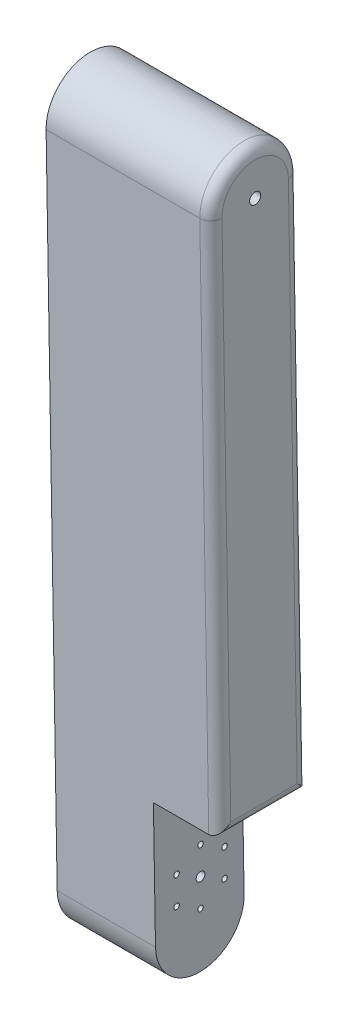
from build123d import *

# Parameters (mm, degrees)
EXTRUDE_3_DEPTH          = 74.4
CUT_EXTRUDE_1_DEPTH      = 30
FILLET_1_R               = 5
CUT_EXTRUDE_6_DEPTH      = 330.484992071
CUT_EXTRUDE_6_DEPTH_BACK = 330.484992071
SKETCH_13_R              = 1.25
CUT_EXTRUDE_7_DEPTH      = 330.484992071
CUT_EXTRUDE_7_DEPTH_BACK = 330.484992071
SKETCH_14_R              = 2
SKETCH_15_R              = 2.5
CUT_EXTRUDE_8_DEPTH      = 100


with BuildPart() as part:
    # 草图4 → 凸台-拉伸3 (new body)
    with BuildSketch(Plane(origin=(0, 0, 0), x_dir=(0, 0, -1), z_dir=(1, 0, 0))):
        with BuildLine():
            Line((-19.997222801, -0.333287047), (-14.997222801, -300.333287047))
            ThreePointArc((-14.997222801, -300.333287047), (5.333287047, -319.997222801), (24.997222801, -299.666712953))
            Line((24.997222801, -299.666712953), (19.997222801, 0.333287047))
            ThreePointArc((19.997222801, 0.333287047), (-0.333287047, 19.997222801), (-19.997222801, -0.333287047))
        make_face()
    extrude(amount=EXTRUDE_3_DEPTH)

    # 草图8 → 切除-拉伸1 (cut)
    with BuildSketch(Plane(origin=(74.4, 0, 0), x_dir=(0, 0, -1), z_dir=(1, 0, 0))):
        with BuildLine():
            Line((-15.947486862, -243.317443397), (24.058068308, -243.317443397))
            Line((24.058068308, -243.317443397), (24.997222801, -299.666712953))
            ThreePointArc((24.997222801, -299.666712953), (4.858283924, -320.480273081), (-15.947486862, -300.333287047))
            Line((-15.947486862, -300.333287047), (-15.947486862, -243.317443397))
        make_face()
    extrude(amount=-CUT_EXTRUDE_1_DEPTH, mode=Mode.SUBTRACT)

    # 圆角1
    fillet_1_edges = [part.edges().sort_by_distance(p)[0] for p in [
        (74.4, -121.492078175, -22.027645554),
        (74.4, -243.317443397, -4.055290723),
        (74.4, 19.997222801, 0.333287047),
        (74.4, -121.825365222, 17.972354831),
    ]]
    fillet(fillet_1_edges, radius=FILLET_1_R)

    # 草图13 → 切除-拉伸6 (cut, two sides: drawn at the far end of the back side and taken through both)
    with BuildSketch(Plane.ZY.offset(-CUT_EXTRUDE_6_DEPTH_BACK)):
        with Locations(Location((-5.333287046, -270.358832161, 0), (0, 0, 180))):
            Circle(SKETCH_13_R)
        with Locations(Location((5.492030501, -276.608832161, 0), (0, 0, 180))):
            Circle(SKETCH_13_R)
        with Locations(Location((5.492030501, -289.108832161, 0), (0, 0, 180))):
            Circle(SKETCH_13_R)
        with Locations(Location((-5.333287046, -295.358832161, 0), (0, 0, 180))):
            Circle(SKETCH_13_R)
        with Locations(Location((-16.158604593, -289.108832161, 0), (0, 0, 180))):
            Circle(SKETCH_13_R)
        with Locations(Location((-16.158604593, -276.608832161, 0), (0, 0, 180))):
            Circle(SKETCH_13_R)
    extrude(amount=CUT_EXTRUDE_6_DEPTH + CUT_EXTRUDE_6_DEPTH_BACK, mode=Mode.SUBTRACT)

    # 草图14 → 切除-拉伸7 (cut, two sides: drawn at the far end of the back side and taken through both)
    with BuildSketch(Plane.ZY.offset(-CUT_EXTRUDE_7_DEPTH_BACK)):
        with Locations(Location((-5.333287046, -282.858832161, 0), (0, 0, 180))):
            Circle(SKETCH_14_R)
    extrude(amount=CUT_EXTRUDE_7_DEPTH + CUT_EXTRUDE_7_DEPTH_BACK, mode=Mode.SUBTRACT)

    # 草图15 → 切除-拉伸8 (cut)
    with BuildSketch(Plane.ZY):
        Circle(SKETCH_15_R)
    extrude(amount=-CUT_EXTRUDE_8_DEPTH, mode=Mode.SUBTRACT)


solid = part.part
